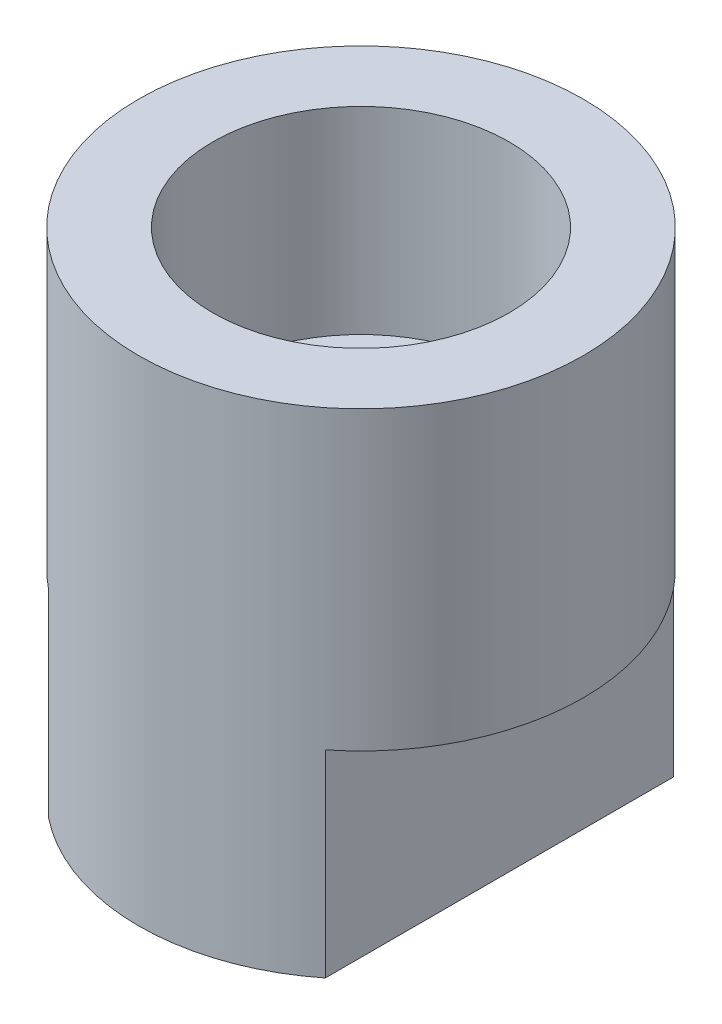
from build123d import *

# Parameters (mm, degrees)
BOSS_EXTRUDE5_DEPTH   = 50
BOSS_EXTRUDE5_2_DEPTH = 50
BOSS_EXTRUDE6_START   = 20
BOSS_EXTRUDE6_DEPTH   = 30
SKETCH1_5_R           = 10
BOSS_EXTRUDE7_DEPTH   = 30
BOSS_EXTRUDE8_START   = 20
BOSS_EXTRUDE8_DEPTH   = 10


with BuildPart() as part:
    # Sketch1 → Boss-Extrude5 (new body)
    with BuildSketch(Plane(origin=(0, 0, 0), x_dir=(1, 0, 0), z_dir=(0, 1, 0))):
        with BuildLine():
            Line((-14, -5.385164807), (-14, -17.613914954))
            ThreePointArc((-14, -17.613914954), (0, -22.5), (14, -17.613914954))
            Line((14, -17.613914954), (14, -5.385164807))
            ThreePointArc((14, -5.385164807), (0, -15), (-14, -5.385164807))
        make_face()
    extrude(amount=BOSS_EXTRUDE5_DEPTH)



with BuildPart() as body_2:
    # Sketch1 → Boss-Extrude5 2 (new body)
    with BuildSketch(Plane(origin=(0, 0, 0), x_dir=(1, 0, 0), z_dir=(0, 1, 0))):
        with BuildLine():
            ThreePointArc((14, 17.613914954), (0, 22.5), (-14, 17.613914954))
            Line((-14, 17.613914954), (-14, 5.385164807))
            ThreePointArc((-14, 5.385164807), (0, 15), (14, 5.385164807))
            Line((14, 5.385164807), (14, 17.613914954))
        make_face()
    extrude(amount=BOSS_EXTRUDE5_2_DEPTH)


with BuildPart() as part_1:
    add(part.part)

    add(body_2.part)  # Boss-Extrude6 merges body 2
    # Sketch1<4> → Boss-Extrude6 (add)
    with BuildSketch(Plane(origin=(0, 0, 0), x_dir=(1, 0, 0), z_dir=(0, 1, 0)).offset(BOSS_EXTRUDE6_START)):
        with BuildLine():
            ThreePointArc((-14, 17.613914954), (-22.5, 0), (-14, -17.613914954))
            Line((-14, -17.613914954), (-14, -5.385164807))
            ThreePointArc((-14, -5.385164807), (-15, 0), (-14, 5.385164807))
            Line((-14, 5.385164807), (-14, 17.613914954))
        make_face()
        with BuildLine():
            Line((14, -5.385164807), (14, -17.613914954))
            ThreePointArc((14, -17.613914954), (22.5, 0), (14, 17.613914954))
            Line((14, 17.613914954), (14, 5.385164807))
            ThreePointArc((14, 5.385164807), (15, 0), (14, -5.385164807))
        make_face()
    extrude(amount=BOSS_EXTRUDE6_DEPTH)

    # Sketch1<5> → Boss-Extrude7 (add)
    with BuildSketch(Plane(origin=(0, 0, 0), x_dir=(1, 0, 0), z_dir=(0, 1, 0))):
        with BuildLine():
            Line((-14, 5.385164807), (-14, -5.385164807))
            ThreePointArc((-14, -5.385164807), (0, -15), (14, -5.385164807))
            Line((14, -5.385164807), (14, 5.385164807))
            ThreePointArc((14, 5.385164807), (0, 15), (-14, 5.385164807))
        make_face()
        Circle(SKETCH1_5_R, mode=Mode.SUBTRACT)
    extrude(amount=BOSS_EXTRUDE7_DEPTH)

    # Sketch1<6> → Boss-Extrude8 (add)
    with BuildSketch(Plane(origin=(0, 0, 0), x_dir=(1, 0, 0), z_dir=(0, 1, 0)).offset(BOSS_EXTRUDE8_START)):
        with BuildLine():
            ThreePointArc((-14, 5.385164807), (-15, 0), (-14, -5.385164807))
            Line((-14, -5.385164807), (-14, 5.385164807))
        make_face()
        with BuildLine():
            Line((14, 5.385164807), (14, -5.385164807))
            ThreePointArc((14, -5.385164807), (15, 0), (14, 5.385164807))
        make_face()
    extrude(amount=BOSS_EXTRUDE8_DEPTH)


solid = part_1.part
